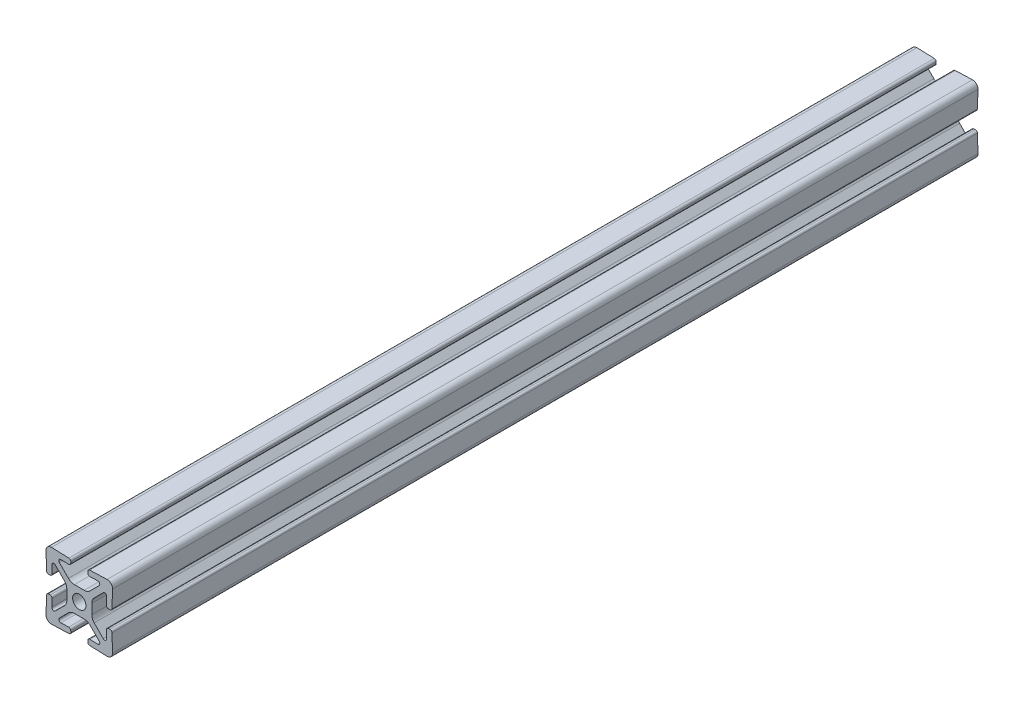
from build123d import *

# Parameters (mm, degrees)
BOSS_EXTRUDE1_DEPTH = 609.6
CIRPATTERN1_COUNT   = 4
CUT_EXTRUDE1_DEPTH  = 889


with BuildPart() as part:
    # Sketch3 → Boss-Extrude1 (new, symmetric)
    with BuildSketch(Plane.XY):
        with BuildLine():
            Line((0, 4.7625), (-1.884807374, 4.7625))
            ThreePointArc((-1.884807374, 4.7625), (-3.099827272, 5.004182484), (-4.129871405, 5.69243597))
            Line((-4.129871405, 5.69243597), (-7.599623114, 9.162187679))
            ThreePointArc((-7.599623114, 9.162187679), (-7.759888701, 10.006330839), (-7.033220609, 10.464824259))
            Line((-7.033220609, 10.464824259), (-4.047481702, 10.360559959))
            ThreePointArc((-4.047481702, 10.360559959), (-3.501205536, 10.564804249), (-3.259352476, 11.095502353))
            Line((-3.259352476, 11.095502353), (-3.23896419, 11.679346474))
            ThreePointArc((-3.23896419, 11.679346474), (-3.443208479, 12.225622641), (-3.973906584, 12.467475701))
            Line((-3.973906584, 12.467475701), (-10.597084223, 12.698762161))
            ThreePointArc((-10.597084223, 12.698762161), (-12.104840979, 12.104840979), (-12.698762161, 10.597084223))
            Line((-12.698762161, 10.597084223), (-12.467475701, 3.973906584))
            ThreePointArc((-12.467475701, 3.973906584), (-12.225622641, 3.443208479), (-11.679346474, 3.23896419))
            Line((-11.679346474, 3.23896419), (-11.095502353, 3.259352476))
            ThreePointArc((-11.095502353, 3.259352476), (-10.564804249, 3.501205536), (-10.360559959, 4.047481702))
            Line((-10.360559959, 4.047481702), (-10.464824259, 7.033220609))
            ThreePointArc((-10.464824259, 7.033220609), (-10.006330839, 7.759888701), (-9.162187679, 7.599623114))
            Line((-9.162187679, 7.599623114), (-5.69243597, 4.129871405))
            ThreePointArc((-5.69243597, 4.129871405), (-5.004182484, 3.099827272), (-4.7625, 1.884807374))
            Line((-4.7625, 1.884807374), (-4.7625, 0))
            Line((-4.7625, 0), (-2.54, 0))
            ThreePointArc((-2.54, 0), (-1.796051224, 1.796051224), (0, 2.54))
            Line((0, 2.54), (0, 4.7625))
        make_face()
    boss_extrude1 = extrude(amount=BOSS_EXTRUDE1_DEPTH, both=True)

    # CirPattern1: Boss-Extrude1 ×4 about axis
    cirpattern1_axis = Axis((0, 0, 0), (0, 0, 1))
    for i in range(1, CIRPATTERN1_COUNT):
        add(boss_extrude1.rotate(cirpattern1_axis, i * 360 / CIRPATTERN1_COUNT))

    # Sketch4 → Cut-Extrude1 (cut)
    with BuildSketch(Plane.XY.offset(609.6)):
        with BuildLine():
            Line((1.884807374, 4.7625), (-1.884807374, 4.7625))
            ThreePointArc((-1.884807374, 4.7625), (-3.099827272, 5.004182484), (-4.129871405, 5.69243597))
            Line((-4.129871405, 5.69243597), (-7.599623114, 9.162187679))
            ThreePointArc((-7.599623114, 9.162187679), (-7.759888701, 10.006330839), (-7.033220609, 10.464824259))
            Line((-7.033220609, 10.464824259), (-4.047481702, 10.360559959))
            ThreePointArc((-4.047481702, 10.360559959), (-3.501205536, 10.564804249), (-3.259352476, 11.095502353))
            Line((-3.259352476, 11.095502353), (-3.23896419, 11.679346474))
            ThreePointArc((-3.23896419, 11.679346474), (-3.443208479, 12.225622641), (-3.973906584, 12.467475701))
            Line((-3.973906584, 12.467475701), (-10.597084223, 12.698762161))
            ThreePointArc((-10.597084223, 12.698762161), (-12.104840979, 12.104840979), (-12.698762161, 10.597084223))
            Line((-12.698762161, 10.597084223), (-12.467475701, 3.973906584))
            ThreePointArc((-12.467475701, 3.973906584), (-12.225622641, 3.443208479), (-11.679346474, 3.23896419))
            Line((-11.679346474, 3.23896419), (-11.095502353, 3.259352476))
            ThreePointArc((-11.095502353, 3.259352476), (-10.564804249, 3.501205536), (-10.360559959, 4.047481702))
            Line((-10.360559959, 4.047481702), (-10.464824259, 7.033220609))
            ThreePointArc((-10.464824259, 7.033220609), (-10.006330839, 7.759888701), (-9.162187679, 7.599623114))
            Line((-9.162187679, 7.599623114), (-5.69243597, 4.129871405))
            ThreePointArc((-5.69243597, 4.129871405), (-5.004182484, 3.099827272), (-4.7625, 1.884807374))
            Line((-4.7625, 1.884807374), (-4.7625, -1.884807374))
            ThreePointArc((-4.7625, -1.884807374), (-5.004182484, -3.099827272), (-5.69243597, -4.129871405))
            Line((-5.69243597, -4.129871405), (-9.162187679, -7.599623114))
            ThreePointArc((-9.162187679, -7.599623114), (-10.006330839, -7.759888701), (-10.464824259, -7.033220609))
            Line((-10.464824259, -7.033220609), (-10.360559959, -4.047481702))
            ThreePointArc((-10.360559959, -4.047481702), (-10.564804249, -3.501205536), (-11.095502353, -3.259352476))
            Line((-11.095502353, -3.259352476), (-11.679346474, -3.23896419))
            ThreePointArc((-11.679346474, -3.23896419), (-12.225622641, -3.443208479), (-12.467475701, -3.973906584))
            Line((-12.467475701, -3.973906584), (-12.698762161, -10.597084223))
            ThreePointArc((-12.698762161, -10.597084223), (-12.104840979, -12.104840979), (-10.597084223, -12.698762161))
            Line((-10.597084223, -12.698762161), (-3.973906584, -12.467475701))
            ThreePointArc((-3.973906584, -12.467475701), (-3.443208479, -12.225622641), (-3.23896419, -11.679346474))
            Line((-3.23896419, -11.679346474), (-3.259352476, -11.095502353))
            ThreePointArc((-3.259352476, -11.095502353), (-3.501205536, -10.564804249), (-4.047481702, -10.360559959))
            Line((-4.047481702, -10.360559959), (-7.033220609, -10.464824259))
            ThreePointArc((-7.033220609, -10.464824259), (-7.759888701, -10.006330839), (-7.599623114, -9.162187679))
            Line((-7.599623114, -9.162187679), (-4.129871405, -5.69243597))
            ThreePointArc((-4.129871405, -5.69243597), (-3.099827272, -5.004182484), (-1.884807374, -4.7625))
            Line((-1.884807374, -4.7625), (1.884807374, -4.7625))
            ThreePointArc((1.884807374, -4.7625), (3.099827272, -5.004182484), (4.129871405, -5.69243597))
            Line((4.129871405, -5.69243597), (7.599623114, -9.162187679))
            ThreePointArc((7.599623114, -9.162187679), (7.759888701, -10.006330839), (7.033220609, -10.464824259))
            Line((7.033220609, -10.464824259), (4.047481702, -10.360559959))
            ThreePointArc((4.047481702, -10.360559959), (3.501205536, -10.564804249), (3.259352476, -11.095502353))
            Line((3.259352476, -11.095502353), (3.23896419, -11.679346474))
            ThreePointArc((3.23896419, -11.679346474), (3.443208479, -12.225622641), (3.973906584, -12.467475701))
            Line((3.973906584, -12.467475701), (10.597084223, -12.698762161))
            ThreePointArc((10.597084223, -12.698762161), (12.104840979, -12.104840979), (12.698762161, -10.597084223))
            Line((12.698762161, -10.597084223), (12.467475701, -3.973906584))
            ThreePointArc((12.467475701, -3.973906584), (12.225622641, -3.443208479), (11.679346474, -3.23896419))
            Line((11.679346474, -3.23896419), (11.095502353, -3.259352476))
            ThreePointArc((11.095502353, -3.259352476), (10.564804249, -3.501205536), (10.360559959, -4.047481702))
            Line((10.360559959, -4.047481702), (10.464824259, -7.033220609))
            ThreePointArc((10.464824259, -7.033220609), (10.006330839, -7.759888701), (9.162187679, -7.599623114))
            Line((9.162187679, -7.599623114), (5.69243597, -4.129871405))
            ThreePointArc((5.69243597, -4.129871405), (5.004182484, -3.099827272), (4.7625, -1.884807374))
            Line((4.7625, -1.884807374), (4.7625, 1.884807374))
            ThreePointArc((4.7625, 1.884807374), (5.004182484, 3.099827272), (5.69243597, 4.129871405))
            Line((5.69243597, 4.129871405), (9.162187679, 7.599623114))
            ThreePointArc((9.162187679, 7.599623114), (10.006330839, 7.759888701), (10.464824259, 7.033220609))
            Line((10.464824259, 7.033220609), (10.360559959, 4.047481702))
            ThreePointArc((10.360559959, 4.047481702), (10.564804249, 3.501205536), (11.095502353, 3.259352476))
            Line((11.095502353, 3.259352476), (11.679346474, 3.23896419))
            ThreePointArc((11.679346474, 3.23896419), (12.225622641, 3.443208479), (12.467475701, 3.973906584))
            Line((12.467475701, 3.973906584), (12.698762161, 10.597084223))
            ThreePointArc((12.698762161, 10.597084223), (12.104840979, 12.104840979), (10.597084223, 12.698762161))
            Line((10.597084223, 12.698762161), (3.973906584, 12.467475701))
            ThreePointArc((3.973906584, 12.467475701), (3.443208479, 12.225622641), (3.23896419, 11.679346474))
            Line((3.23896419, 11.679346474), (3.259352476, 11.095502353))
            ThreePointArc((3.259352476, 11.095502353), (3.501205536, 10.564804249), (4.047481702, 10.360559959))
            Line((4.047481702, 10.360559959), (7.033220609, 10.464824259))
            ThreePointArc((7.033220609, 10.464824259), (7.759888701, 10.006330839), (7.599623114, 9.162187679))
            Line((7.599623114, 9.162187679), (4.129871405, 5.69243597))
            ThreePointArc((4.129871405, 5.69243597), (3.099827272, 5.004182484), (1.884807374, 4.7625))
        make_face()
    extrude(amount=-CUT_EXTRUDE1_DEPTH, mode=Mode.SUBTRACT)


solid = part.part
